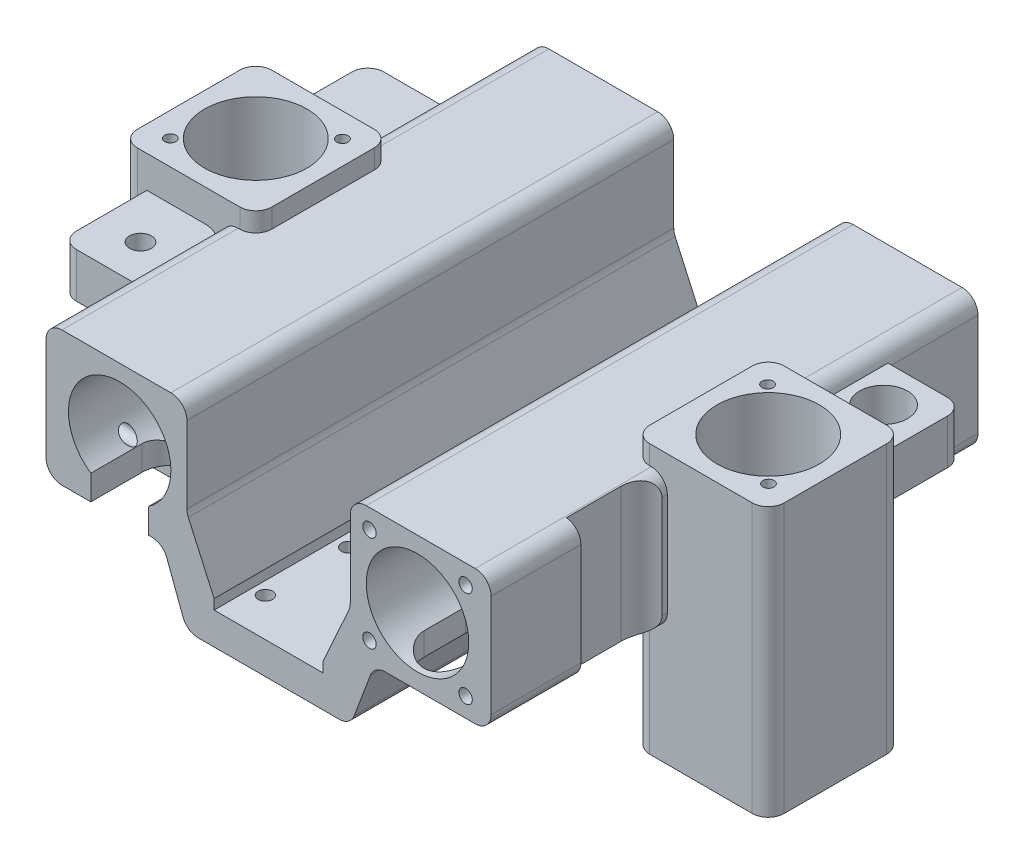
from build123d import *

# Parameters (mm, degrees)
SKETCH_1_R             = 14
SKETCH_1_R_2           = 16
EXTRUDE_1_DEPTH        = 152
SKETCH_3_R             = 16
EXTRUDE_2_DEPTH        = 84
SKETCH_4_R             = 1.75
CUT_EXTRUDE_3_DEPTH    = 15
CUT_EXTRUDE_START      = -15
SKETCH_5_R             = 1.75
SKETCH_5_R_2           = 1.785128224
CUT_EXTRUDE_4_DEPTH    = 15
SKETCH_6_R             = 7.5
SKETCH_6_R_2           = 3.4
EXTRUDE_5_DEPTH        = 14
CUT_EXTRUDE_6_REACH    = 2802.318
SKETCH_9_R             = 2.25
CUT_EXTRUDE_7_DEPTH    = 2801.732635123
SKETCH_10_R            = 4.25
CUT_EXTRUDE_8_DEPTH    = 5
CUT_EXTRUDE_9_REACH    = 1133.499
SKETCH_12_R            = 2.1
CUT_EXTRUDE_11_DEPTH   = 50
SKETCH_14_R            = 16
CUT_EXTRUDE_12_DEPTH   = 2802.166773586
SKETCH_15_R            = 16
CUT_EXTRUDE_13_DEPTH   = 3012.244593287
SKETCH_16_R            = 2.1
CUT_EXTRUDE_14_DEPTH   = 15
HOLE_WIZARD_M5_1_D     = 4.2
HOLE_WIZARD_M5_1_DEPTH = 12.4
HOLE_WIZARD_M5_1_TIP   = 1.2618073


with BuildPart() as part:
    # 草图1 → 拉伸1 (new body)
    with BuildSketch(Plane.XY):
        with BuildLine():
            Line((2731.243121827, 1060.203369048), (2759.278119486, 1060.203369048))
            ThreePointArc((2759.278119486, 1060.203369048), (2762.813653392, 1061.667835142), (2764.278119486, 1065.203369048))
            Line((2764.278119486, 1065.203369048), (2764.278119486, 1097.203369048))
            ThreePointArc((2764.278119486, 1097.203369048), (2762.813653392, 1100.738902954), (2759.278119486, 1102.203369048))
            Line((2759.278119486, 1102.203369048), (2725.278119486, 1102.203369048))
            ThreePointArc((2725.278119486, 1102.203369048), (2721.74258558, 1100.738902954), (2720.278119486, 1097.203369048))
            Line((2720.278119486, 1097.203369048), (2720.278119486, 1073.276542492))
            ThreePointArc((2720.278119486, 1073.276542492), (2720.166781759, 1072.227265987), (2719.837727012, 1071.224719106))
            Line((2719.837727012, 1071.224719106), (2711.778119486, 1053.314480159))
            Line((2711.778119486, 1053.314480159), (2711.778119486, 1050.203369048))
            Line((2711.778119486, 1050.203369048), (2677.778119486, 1050.203369048))
            Line((2677.778119486, 1050.203369048), (2677.778119486, 1053.314480159))
            Line((2677.778119486, 1053.314480159), (2669.71851196, 1071.224719106))
            ThreePointArc((2669.71851196, 1071.224719106), (2669.389457214, 1072.227265987), (2669.278119486, 1073.276542492))
            Line((2669.278119486, 1073.276542492), (2669.278119486, 1097.203369048))
            ThreePointArc((2669.278119486, 1097.203369048), (2667.813653392, 1100.738902954), (2664.278119486, 1102.203369048))
            Line((2664.278119486, 1102.203369048), (2630.278119486, 1102.203369048))
            ThreePointArc((2630.278119486, 1102.203369048), (2626.74258558, 1100.738902954), (2625.278119486, 1097.203369048))
            Line((2625.278119486, 1097.203369048), (2625.278119486, 1065.203369048))
            ThreePointArc((2625.278119486, 1065.203369048), (2626.74258558, 1061.667835142), (2630.278119486, 1060.203369048))
            Line((2630.278119486, 1060.203369048), (2658.313117145, 1060.203369048))
            ThreePointArc((2658.313117145, 1060.203369048), (2661.161091334, 1059.312997136), (2662.994763033, 1056.958986256))
            Line((2662.994763033, 1056.958986256), (2668.061475939, 1043.44775184))
            ThreePointArc((2668.061475939, 1043.44775184), (2669.895147638, 1041.09374096), (2672.743121827, 1040.203369048))
            Line((2672.743121827, 1040.203369048), (2716.813117145, 1040.203369048))
            ThreePointArc((2716.813117145, 1040.203369048), (2719.661091334, 1041.09374096), (2721.494763033, 1043.44775184))
            Line((2721.494763033, 1043.44775184), (2726.561475939, 1056.958986256))
            ThreePointArc((2726.561475939, 1056.958986256), (2728.395147638, 1059.312997136), (2731.243121827, 1060.203369048))
        make_face()
        with Locations((2648.278119486, 1081.203369048)):
            Circle(SKETCH_1_R, mode=Mode.SUBTRACT)
        with Locations((2741.278119486, 1081.203369048)):
            Circle(SKETCH_1_R_2, mode=Mode.SUBTRACT)
    extrude(amount=EXTRUDE_1_DEPTH)

    # 草图3 → 拉伸2 (add)
    # profile 1 of 2: a face of its own
    with BuildSketch(Plane(origin=(0, 1108.203369048, 0), x_dir=(-1, 0, 0), z_dir=(0, 1, 0))):
        with BuildLine():
            Line((-2598.778119486, 55), (-2630.778119486, 55))
            ThreePointArc((-2630.778119486, 55), (-2634.313653392, 56.464466094), (-2635.778119486, 60))
            Line((-2635.778119486, 60), (-2635.778119486, 92))
            ThreePointArc((-2635.778119486, 92), (-2634.313653392, 95.535533906), (-2630.778119486, 97))
            Line((-2630.778119486, 97), (-2598.778119486, 97))
            ThreePointArc((-2598.778119486, 97), (-2595.24258558, 95.535533906), (-2593.778119486, 92))
            Line((-2593.778119486, 92), (-2593.778119486, 60))
            ThreePointArc((-2593.778119486, 60), (-2595.24258558, 56.464466094), (-2598.778119486, 55))
        make_face()
        with Locations((-2614.778119486, 76)):
            Circle(SKETCH_3_R, mode=Mode.SUBTRACT)
    # profile 2 of 2: a face of its own
    with BuildSketch(Plane(origin=(0, 1108.203369048, 0), x_dir=(-1, 0, 0), z_dir=(0, 1, 0))):
        with BuildLine():
            Line((-2790.778119486, 97), (-2758.778119486, 97))
            ThreePointArc((-2758.778119486, 97), (-2755.24258558, 95.535533906), (-2753.778119486, 92))
            Line((-2753.778119486, 92), (-2753.778119486, 60))
            ThreePointArc((-2753.778119486, 60), (-2755.24258558, 56.464466094), (-2758.778119486, 55))
            Line((-2758.778119486, 55), (-2790.778119486, 55))
            ThreePointArc((-2790.778119486, 55), (-2794.313653392, 56.464466094), (-2795.778119486, 60))
            Line((-2795.778119486, 60), (-2795.778119486, 92))
            ThreePointArc((-2795.778119486, 92), (-2794.313653392, 95.535533906), (-2790.778119486, 97))
        make_face()
        with Locations(Location((-2774.778119486, 76, 0), (0, 0, 180))):
            Circle(SKETCH_3_R, mode=Mode.SUBTRACT)
    extrude(amount=-EXTRUDE_2_DEPTH)

    # 草图4 → 拉伸3 (cut)
    with BuildSketch(Plane(origin=(0, 1108.203369048, 0), x_dir=(-1, 0, 0), z_dir=(0, 1, 0))):
        with Locations((-2601.390549305, 89.299894744)):
            Circle(SKETCH_4_R)
        with Locations((-2628.403243372, 62.57323466)):
            Circle(SKETCH_4_R)
        with Locations(Location((-2761.1529956, 62.57323466, 0), (0, 0, 180))):
            Circle(SKETCH_4_R)
        with Locations(Location((-2788.165689667, 89.299894744, 0), (0, 0, 180))):
            Circle(SKETCH_4_R)
    extrude(amount=-CUT_EXTRUDE_3_DEPTH, mode=Mode.SUBTRACT)

    # 草图5 → 拉伸4 (cut)
    with BuildSketch(Plane.XZ.offset(-1024.203369048).offset(CUT_EXTRUDE_START)):
        with Locations(Location((2601.390549305, 89.299894744, 0), (0, 0, 180))):
            Circle(SKETCH_5_R)
        with Locations(Location((2628.403243372, 62.57323466, 0), (0, 0, 180))):
            Circle(SKETCH_5_R)
        with Locations((2788.165689667, 89.299894744)):
            Circle(SKETCH_5_R_2)
        with Locations((2761.1529956, 62.57323466)):
            Circle(SKETCH_5_R)
    extrude(amount=CUT_EXTRUDE_4_DEPTH, mode=Mode.SUBTRACT)

    # 草图6 → 拉伸5 (add)
    # profile 1 of 4: a face of its own
    with BuildSketch(Plane(origin=(0, 1084.203369048, 0), x_dir=(-1, 0, 0), z_dir=(0, 1, 0))):
        with BuildLine():
            Line((-2606.778119486, 28), (-2629.778119486, 28))
            Line((-2629.778119486, 28), (-2629.778119486, 45))
            ThreePointArc((-2629.778119486, 45), (-2626.849187298, 52.071067812), (-2619.778119486, 55))
            Line((-2619.778119486, 55), (-2601.778119486, 55))
            Line((-2601.778119486, 55), (-2601.778119486, 52.509729436))
            Line((-2601.778119486, 52.509729436), (-2601.778119486, 33))
            ThreePointArc((-2601.778119486, 33), (-2603.24258558, 29.464466094), (-2606.778119486, 28))
        make_face()
    # profile 2 of 4: a face of its own
    with BuildSketch(Plane(origin=(0, 1084.203369048, 0), x_dir=(-1, 0, 0), z_dir=(0, 1, 0))):
        with BuildLine():
            Line((-2787.778119486, 55), (-2769.778119486, 55))
            ThreePointArc((-2769.778119486, 55), (-2762.707051674, 52.071067812), (-2759.778119486, 45))
            Line((-2759.778119486, 45), (-2759.778119486, 28))
            Line((-2759.778119486, 28), (-2782.778119486, 28))
            ThreePointArc((-2782.778119486, 28), (-2786.313653392, 29.464466094), (-2787.778119486, 33))
            Line((-2787.778119486, 33), (-2787.778119486, 52.509729436))
            Line((-2787.778119486, 52.509729436), (-2787.778119486, 55))
        make_face()
        with Locations((-2774.778119486, 40)):
            Circle(SKETCH_6_R, mode=Mode.SUBTRACT)
    # profile 3 of 4: a face of its own
    with BuildSketch(Plane(origin=(0, 1084.203369048, 0), x_dir=(-1, 0, 0), z_dir=(0, 1, 0))):
        with BuildLine():
            Line((-2759.778119486, 124), (-2759.778119486, 107))
            ThreePointArc((-2759.778119486, 107), (-2762.707051674, 99.928932188), (-2769.778119486, 97))
            Line((-2769.778119486, 97), (-2787.778119486, 97))
            Line((-2787.778119486, 97), (-2787.778119486, 119))
            ThreePointArc((-2787.778119486, 119), (-2786.313653392, 122.535533906), (-2782.778119486, 124))
            Line((-2782.778119486, 124), (-2759.778119486, 124))
        make_face()
    # profile 4 of 4: a face of its own
    with BuildSketch(Plane(origin=(0, 1084.203369048, 0), x_dir=(-1, 0, 0), z_dir=(0, 1, 0))):
        with BuildLine():
            Line((-2601.778119486, 97), (-2619.778119486, 97))
            ThreePointArc((-2619.778119486, 97), (-2626.849187298, 99.928932188), (-2629.778119486, 107))
            Line((-2629.778119486, 107), (-2629.778119486, 124))
            Line((-2629.778119486, 124), (-2606.778119486, 124))
            ThreePointArc((-2606.778119486, 124), (-2603.24258558, 122.535533906), (-2601.778119486, 119))
            Line((-2601.778119486, 119), (-2601.778119486, 99.490270564))
            Line((-2601.778119486, 99.490270564), (-2601.778119486, 97))
        make_face()
        with Locations((-2614.778119486, 112)):
            Circle(SKETCH_6_R_2, mode=Mode.SUBTRACT)
    extrude(amount=EXTRUDE_5_DEPTH)

    # 草图7 → 拉伸6 (cut, up to next)
    with BuildSketch(Plane.XZ.offset(-1060.203369048), mode=Mode.PRIVATE) as cut_extrude_6_sk1:
        with BuildLine():
            Line((2639.278119486, 152), (2639.278119486, 136))
            ThreePointArc((2639.278119486, 136), (2648.278119486, 127), (2657.278119486, 136))
            Line((2657.278119486, 136), (2657.278119486, 152))
            Line((2657.278119486, 152), (2639.278119486, 152))
        make_face()
    cut_extrude_6_tool1 = extrude(cut_extrude_6_sk1.sketch, amount=-CUT_EXTRUDE_6_REACH, mode=Mode.PRIVATE) & part.part
    # 草图7 → 拉伸6 (cut, up to next)
    with BuildSketch(Plane.XZ.offset(-1060.203369048), mode=Mode.PRIVATE) as cut_extrude_6_sk2:
        with BuildLine():
            Line((2657.278119486, 0), (2639.278119486, 0))
            Line((2639.278119486, 0), (2639.278119486, 16))
            ThreePointArc((2639.278119486, 16), (2648.278119486, 25), (2657.278119486, 16))
            Line((2657.278119486, 16), (2657.278119486, 0))
        make_face()
    cut_extrude_6_tool2 = extrude(cut_extrude_6_sk2.sketch, amount=-CUT_EXTRUDE_6_REACH, mode=Mode.PRIVATE) & part.part
    # 草图7 → 拉伸6 (cut, up to next)
    with BuildSketch(Plane.XZ.offset(-1060.203369048), mode=Mode.PRIVATE) as cut_extrude_6_sk3:
        with BuildLine():
            Line((2749.278119486, 142), (2749.278119486, 129))
            ThreePointArc((2749.278119486, 129), (2741.278119486, 121), (2733.278119486, 129))
            Line((2733.278119486, 129), (2733.278119486, 142))
            ThreePointArc((2733.278119486, 142), (2741.278119486, 150), (2749.278119486, 142))
        make_face()
    cut_extrude_6_tool3 = extrude(cut_extrude_6_sk3.sketch, amount=-CUT_EXTRUDE_6_REACH, mode=Mode.PRIVATE) & part.part
    # 草图7 → 拉伸6 (cut, up to next)
    with BuildSketch(Plane.XZ.offset(-1060.203369048), mode=Mode.PRIVATE) as cut_extrude_6_sk4:
        with BuildLine():
            Line((2733.278119486, 23), (2733.278119486, 10))
            ThreePointArc((2733.278119486, 10), (2741.278119486, 2), (2749.278119486, 10))
            Line((2749.278119486, 10), (2749.278119486, 23))
            ThreePointArc((2749.278119486, 23), (2741.278119486, 31), (2733.278119486, 23))
        make_face()
    cut_extrude_6_tool4 = extrude(cut_extrude_6_sk4.sketch, amount=-CUT_EXTRUDE_6_REACH, mode=Mode.PRIVATE) & part.part
    add(cut_extrude_6_tool1.solids().sort_by_distance((2648.278119, 1060.203369, 140.378249))[0], mode=Mode.SUBTRACT)
    add(cut_extrude_6_tool2.solids().sort_by_distance((2648.278119, 1060.203369, 11.621751))[0], mode=Mode.SUBTRACT)
    add(cut_extrude_6_tool3.solids().sort_by_distance((2741.278119, 1060.203369, 135.5))[0], mode=Mode.SUBTRACT)
    add(cut_extrude_6_tool4.solids().sort_by_distance((2741.278119, 1060.203369, 16.5))[0], mode=Mode.SUBTRACT)

    # 草图9 → 拉伸7 (cut, through all)
    with BuildSketch(Plane.XZ.offset(-1040.203369048)):
        with Locations(Location((2681.778119486, 140, 0), (0, 0, 270))):
            Circle(SKETCH_9_R)
        with Locations(Location((2707.778119486, 140, 0), (0, 0, 270))):
            Circle(SKETCH_9_R)
        with Locations(Location((2681.778119486, 114, 0), (0, 0, 270))):
            Circle(SKETCH_9_R)
        with Locations(Location((2707.778119486, 114, 0), (0, 0, 270))):
            Circle(SKETCH_9_R)
    cut_extrude_7 = extrude(amount=-CUT_EXTRUDE_7_DEPTH, mode=Mode.SUBTRACT)

    # 草图10 → 拉伸8 (cut)
    with BuildSketch(Plane.XZ.offset(-1040.203369048)):
        with Locations(Location((2681.778119486, 140, 0), (0, 0, 270))):
            Circle(SKETCH_10_R)
        with Locations(Location((2707.778119486, 140, 0), (0, 0, 270))):
            Circle(SKETCH_10_R)
        with Locations(Location((2707.778119486, 114, 0), (0, 0, 270))):
            Circle(SKETCH_10_R)
        with Locations(Location((2681.778119486, 114, 0), (0, 0, 270))):
            Circle(SKETCH_10_R)
    cut_extrude_8 = extrude(amount=-CUT_EXTRUDE_8_DEPTH, mode=Mode.SUBTRACT)

    # 镜向1: 拉伸7, 拉伸8 across plane
    add(cut_extrude_7.mirror(Plane.XY.offset(76)), mode=Mode.SUBTRACT)
    add(cut_extrude_8.mirror(Plane.XY.offset(76)), mode=Mode.SUBTRACT)

    # 草图12 → 拉伸9 (cut, up to next)
    with BuildSketch(Plane.ZY.offset(-2625.278119486), mode=Mode.PRIVATE) as cut_extrude_9_sk1:
        with Locations((138, 1092.203369048)):
            Circle(SKETCH_12_R)
    cut_extrude_9_tool1 = extrude(cut_extrude_9_sk1.sketch, amount=-CUT_EXTRUDE_9_REACH, mode=Mode.PRIVATE) & part.part
    # 草图12 → 拉伸9 (cut, up to next)
    with BuildSketch(Plane.ZY.offset(-2625.278119486), mode=Mode.PRIVATE) as cut_extrude_9_sk2:
        with Locations((138, 1070.203369048)):
            Circle(SKETCH_12_R)
    cut_extrude_9_tool2 = extrude(cut_extrude_9_sk2.sketch, amount=-CUT_EXTRUDE_9_REACH, mode=Mode.PRIVATE) & part.part
    add(cut_extrude_9_tool1.solids().sort_by_distance((2625.278119, 1092.203369, 138))[0], mode=Mode.SUBTRACT)
    add(cut_extrude_9_tool2.solids().sort_by_distance((2625.278119, 1070.203369, 138))[0], mode=Mode.SUBTRACT)

    # 草图13 → 拉伸11 (cut, symmetric)
    with BuildSketch(Plane.XZ.offset(-1084.203369048)):
        with BuildLine():
            Line((2759.778119486, 124), (2759.778119486, 107))
            ThreePointArc((2759.778119486, 107), (2762.707051674, 99.928932188), (2769.778119486, 97))
            Line((2769.778119486, 97), (2787.778119486, 97))
            Line((2787.778119486, 97), (2787.778119486, 119))
            ThreePointArc((2787.778119486, 119), (2786.313653392, 122.535533906), (2782.778119486, 124))
            Line((2782.778119486, 124), (2759.778119486, 124))
        make_face()
    extrude(amount=CUT_EXTRUDE_11_DEPTH, both=True, mode=Mode.SUBTRACT)

    # 草图14 → 拉伸12 (cut, through all)
    with BuildSketch(Plane.XZ.offset(-1024.203369048)):
        with Locations(Location((2614.778119486, 76, 0), (0, 0, 180))):
            Circle(SKETCH_14_R)
        with Locations(Location((2774.778119486, 76, 0), (0, 0, 180))):
            Circle(SKETCH_14_R)
    extrude(amount=-CUT_EXTRUDE_12_DEPTH, mode=Mode.SUBTRACT)

    # 草图15 → 拉伸13 (cut, through all)
    with BuildSketch(Plane.XY.offset(152)):
        with Locations(Location((2648.278119486, 1081.203369048, 0), (0, 0, 304.228866328))):
            Circle(SKETCH_15_R)
        with Locations((2741.278119486, 1081.203369048)):
            Circle(SKETCH_15_R)
    extrude(amount=-CUT_EXTRUDE_13_DEPTH, mode=Mode.SUBTRACT)

    # 草图16 → 拉伸14 (cut)
    with BuildSketch(Plane(origin=(0, 0, 0), x_dir=(-1, 0, 0), z_dir=(0, 0, -1))):
        with Locations((-2756.278119486, 1096.203369048)):
            Circle(SKETCH_16_R)
        with Locations((-2726.278119486, 1096.203369048)):
            Circle(SKETCH_16_R)
        with Locations((-2726.278119486, 1066.203369048)):
            Circle(SKETCH_16_R)
        with Locations((-2756.278119486, 1066.203369048)):
            Circle(SKETCH_16_R)
    cut_extrude_14 = extrude(amount=-CUT_EXTRUDE_14_DEPTH, mode=Mode.SUBTRACT)

    # 镜向3: 拉伸14 across plane
    add(cut_extrude_14.mirror(Plane.XY.offset(76)), mode=Mode.SUBTRACT)

    # M5 螺纹孔1
    with Locations(Plane.ZY.offset(-2625.278119486)):
        with Locations((17, 1070.203369048), (17, 1092.203369048)):
            Hole(HOLE_WIZARD_M5_1_D / 2, depth=HOLE_WIZARD_M5_1_DEPTH)
            with Locations((0, 0, -(HOLE_WIZARD_M5_1_DEPTH + HOLE_WIZARD_M5_1_TIP / 2))):  # 118° drill point
                Cone(0, HOLE_WIZARD_M5_1_D / 2, HOLE_WIZARD_M5_1_TIP, mode=Mode.SUBTRACT)


solid = part.part
